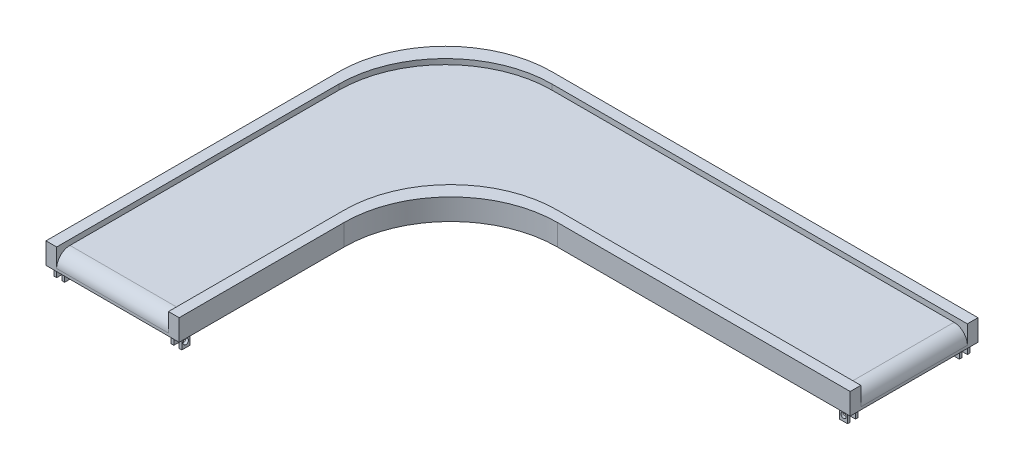
from build123d import *

# Parameters (mm, degrees)
BOSS_EXTRUDE1_DEPTH = 203.2
CUT_EXTRUDE1_DEPTH  = 50.8
FILLET1_R           = 127
SKETCH3_W           = 76.2
SKETCH3_H           = 25.4
SKETCH3_W_2         = 24.697709427
SKETCH3_H_2         = 76.2
SKETCH3_W_3         = 25.4
BOSS_EXTRUDE2_DEPTH = 101.6
SKETCH4_R           = 25.4
CUT_EXTRUDE2_DEPTH  = 1270
SKETCH5_R           = 25.4
CUT_EXTRUDE3_DEPTH  = 1270


with BuildPart() as part:
    # Sketch1 → Boss-Extrude1 (new body)
    with BuildSketch(Plane(origin=(0, 0, 0), x_dir=(1, 0, 0), z_dir=(0, 1, 0))):
        with BuildLine():
            Line((1016, 0), (5080, 0))
            Line((5080, 0), (5080, -1219.2))
            Line((5080, -1219.2), (2286, -1219.2))
            ThreePointArc((2286, -1219.2), (1567.579510314, -1516.779510314), (1270, -2235.2))
            Line((1270, -2235.2), (1270, -3810))
            Line((1270, -3810), (0, -3810))
            Line((0, -3810), (0, -1016))
            ThreePointArc((0, -1016), (297.579510314, -297.579510314), (1016, 0))
        make_face()
    extrude(amount=BOSS_EXTRUDE1_DEPTH)

    # Sketch2 → Cut-Extrude1 (cut)
    with BuildSketch(Plane(origin=(0, 203.2, 0), x_dir=(1, 0, 0), z_dir=(0, 1, 0))):
        with BuildLine():
            Line((101.6, -1117.6), (101.6, -3810))
            Line((101.6, -3810), (1168.4, -3810))
            Line((1168.4, -3810), (1168.4, -2133.6))
            ThreePointArc((1168.4, -2133.6), (1465.979510314, -1415.179510314), (2184.4, -1117.6))
            Line((2184.4, -1117.6), (5080, -1117.6))
            Line((5080, -1117.6), (5080, -101.6))
            Line((5080, -101.6), (1117.6, -101.6))
            ThreePointArc((1117.6, -101.6), (399.179510314, -399.179510314), (101.6, -1117.6))
        make_face()
    extrude(amount=-CUT_EXTRUDE1_DEPTH, mode=Mode.SUBTRACT)

    # Fillet1
    fillet1_edges = [part.edges().sort_by_distance(p)[0] for p in [
        (5080, 152.4, 609.6),
        (635, 152.4, 3810),
    ]]
    fillet(fillet1_edges, radius=FILLET1_R)

    # Sketch3 → Boss-Extrude2 (add)
    with BuildSketch(Plane(origin=(0, 0, 0), x_dir=(-1, 0, 0), z_dir=(0, -1, 0))):
        with Locations((-4991.1, -38.1)):
            Rectangle(SKETCH3_W, SKETCH3_H)
        with Locations((-4991.1, -114.3)):
            Rectangle(SKETCH3_W, SKETCH3_H)
        with Locations((-4991.1, -1104.9)):
            Rectangle(SKETCH3_W, SKETCH3_H)
        with Locations((-4991.1, -1181.1)):
            Rectangle(SKETCH3_W, SKETCH3_H)
        with Locations((-38.451145287, -3721.1)):
            Rectangle(SKETCH3_W_2, SKETCH3_H_2)
        with Locations((-114.3, -3721.1)):
            Rectangle(SKETCH3_W_3, SKETCH3_H_2)
        with Locations((-1231.9, -3721.1)):
            Rectangle(SKETCH3_W_3, SKETCH3_H_2)
        with Locations((-1155.7, -3721.1)):
            Rectangle(SKETCH3_W_3, SKETCH3_H_2)
    extrude(amount=BOSS_EXTRUDE2_DEPTH)

    # Sketch4 → Cut-Extrude2 (cut)
    with BuildSketch(Plane.ZY.offset(-26.102290573)):
        with Locations((3721.1, -50.8)):
            Circle(SKETCH4_R)
    extrude(amount=-CUT_EXTRUDE2_DEPTH, mode=Mode.SUBTRACT)

    # Sketch5 → Cut-Extrude3 (cut)
    with BuildSketch(Plane(origin=(0, 0, 25.4), x_dir=(-1, 0, 0), z_dir=(0, 0, -1))):
        with Locations((-4991.1, -50.8)):
            Circle(SKETCH5_R)
    extrude(amount=-CUT_EXTRUDE3_DEPTH, mode=Mode.SUBTRACT)


solid = part.part
